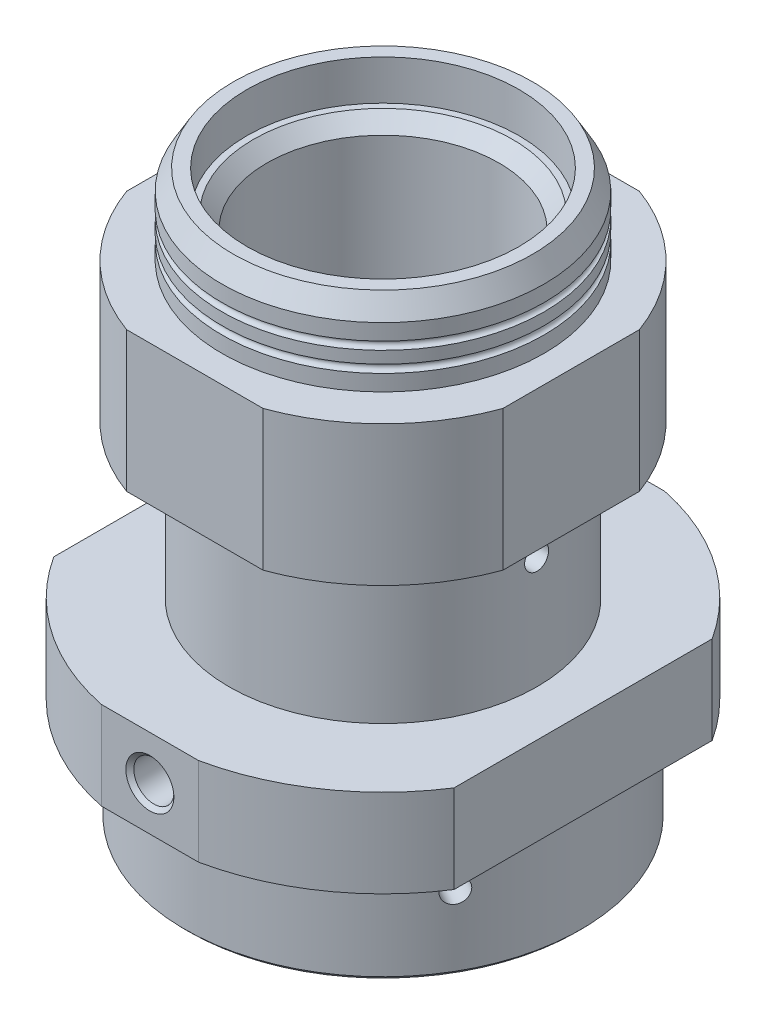
from build123d import *

# Parameters (mm, degrees)
SKETCH2_R               = 3
CUT_EXTRUDE1_DEPTH      = 80
CIRPATTERN1_COUNT       = 3
CUT_EXTRUDE2_DEPTH      = 165.19957369
CUT_EXTRUDE2_DEPTH_BACK = 165.19957369
SKETCH3_W               = 200
SKETCH3_H               = 200
SKETCH3_W_2             = 100
SKETCH3_H_2             = 116.5
SKETCH4_W               = 200
SKETCH4_H               = 200
SKETCH4_W_2             = 94
SKETCH4_H_2             = 94
CUT_EXTRUDE3_DEPTH      = 80
CUT_EXTRUDE4_DEPTH      = 190.613422521
CUT_EXTRUDE4_DEPTH_BACK = 190.613422521
SKETCH5_R               = 5
CHAMFER1_SIZE           = 1
SKETCH6_R               = 7.5
CUT_EXTRUDE5_DEPTH      = 5
CUT_EXTRUDE6_REACH      = 182.785
SKETCH7_R               = 3


with BuildPart() as part:
    # Sketch1 → Revolve1 (revolve)
    with BuildSketch(Plane.XY):
        with BuildLine():
            Line((34, 0), (37.363248654, 0))
            Line((37.363248654, 0), (40.25, -5))
            Line((40.25, -5), (40.25, -9))
            ThreePointArc((40.25, -9), (39.25, -10), (40.25, -11))
            Line((40.25, -11), (40.25, -14))
            ThreePointArc((40.25, -14), (39.25, -15), (40.25, -16))
            Line((40.25, -16), (40.25, -20))
            Line((40.25, -20), (50, -20))
            Line((50, -20), (50, -55))
            Line((50, -55), (38.5, -55))
            Line((38.5, -55), (38.5, -93))
            Line((38.5, -93), (59.5, -93))
            Line((59.5, -93), (59.5, -115))
            Line((59.5, -115), (49.5, -115))
            Line((49.5, -115), (49.5, -140))
            Line((49.5, -140), (48.5, -141))
            Line((48.5, -141), (41.1, -141))
            Line((41.1, -141), (41.1, -137))
            Line((41.1, -137), (43.5, -137))
            ThreePointArc((43.5, -137), (44.207106781, -136.707106781), (44.5, -136))
            Line((44.5, -136), (44.5, -130.7))
            ThreePointArc((44.5, -130.7), (44.207106781, -129.992893219), (43.5, -129.7))
            Line((43.5, -129.7), (41.1, -129.7))
            Line((41.1, -129.7), (41.1, -115))
            Line((41.1, -115), (37.4, -115))
            Line((37.4, -115), (37.4, -119))
            Line((37.4, -119), (30.5, -119))
            Line((30.5, -119), (30.5, -80))
            Line((30.5, -80), (29, -80))
            Line((29, -80), (29, -13.4))
            Line((29, -13.4), (32.4, -10))
            Line((32.4, -10), (34, -10))
            Line((34, -10), (34, 0))
        make_face()
    revolve(axis=Axis((0, 228.281412322, 0), (0, -1, 0)))

    # Sketch2 → Cut-Extrude1 (cut)
    with BuildSketch(Plane.XY):
        with Locations((0, -122.5)):
            Circle(SKETCH2_R)
    cut_extrude1 = extrude(amount=-CUT_EXTRUDE1_DEPTH, mode=Mode.SUBTRACT)

    # CirPattern1: Cut-Extrude1 ×3 about axis
    cirpattern1_axis = Axis((0, 228.281412322, 0), (0, 1, 0))
    for i in range(1, CIRPATTERN1_COUNT):
        add(cut_extrude1.rotate(cirpattern1_axis, i * 360 / CIRPATTERN1_COUNT), mode=Mode.SUBTRACT)

    # Sketch3 → Cut-Extrude2 (cut, two sides: drawn at the far end of the back side and taken through both)
    with BuildSketch(Plane.XZ.offset(141).offset(-CUT_EXTRUDE2_DEPTH_BACK)):
        Rectangle(SKETCH3_W, SKETCH3_H)
        Rectangle(SKETCH3_W_2, SKETCH3_H_2, mode=Mode.SUBTRACT)
    extrude(amount=CUT_EXTRUDE2_DEPTH + CUT_EXTRUDE2_DEPTH_BACK, mode=Mode.SUBTRACT)

    # Sketch4 → Cut-Extrude3 (cut)
    with BuildSketch(Plane(origin=(0, 0, 0), x_dir=(1, 0, 0), z_dir=(0, 1, 0))):
        Rectangle(SKETCH4_W, SKETCH4_H)
        Rectangle(SKETCH4_W_2, SKETCH4_H_2, mode=Mode.SUBTRACT)
    extrude(amount=-CUT_EXTRUDE3_DEPTH, mode=Mode.SUBTRACT)

    # Sketch5 → Cut-Extrude4 (cut, two sides: drawn at the far end of the back side and taken through both)
    with BuildSketch(Plane.XY.offset(58.25).offset(-CUT_EXTRUDE4_DEPTH_BACK)):
        with Locations((0, -104)):
            Circle(SKETCH5_R)
    extrude(amount=CUT_EXTRUDE4_DEPTH + CUT_EXTRUDE4_DEPTH_BACK, mode=Mode.SUBTRACT)

    # Chamfer1
    chamfer1_edges = [part.edges().sort_by_distance(p)[0] for p in [
        (-5, -104, 58.25),
    ]]
    chamfer(chamfer1_edges, length=CHAMFER1_SIZE)

    # Sketch6 → Cut-Extrude5 (cut)
    with BuildSketch(Plane(origin=(0, 0, -58.25), x_dir=(-1, 0, 0), z_dir=(0, 0, -1))):
        with Locations((0, -104)):
            Circle(SKETCH6_R)
    extrude(amount=-CUT_EXTRUDE5_DEPTH, mode=Mode.SUBTRACT)

    # Sketch7 → Cut-Extrude6 (cut, up to next)
    with BuildSketch(Plane(origin=(47, 0, 0), x_dir=(0, 0, -1), z_dir=(1, 0, 0)), mode=Mode.PRIVATE) as cut_extrude6_sk1:
        with Locations((0, -65)):
            Circle(SKETCH7_R)
    cut_extrude6_tool1 = extrude(cut_extrude6_sk1.sketch, amount=-CUT_EXTRUDE6_REACH, mode=Mode.PRIVATE) & part.part
    add(cut_extrude6_tool1.solids().sort_by_distance((47, -65, 0))[0], mode=Mode.SUBTRACT)


solid = part.part
